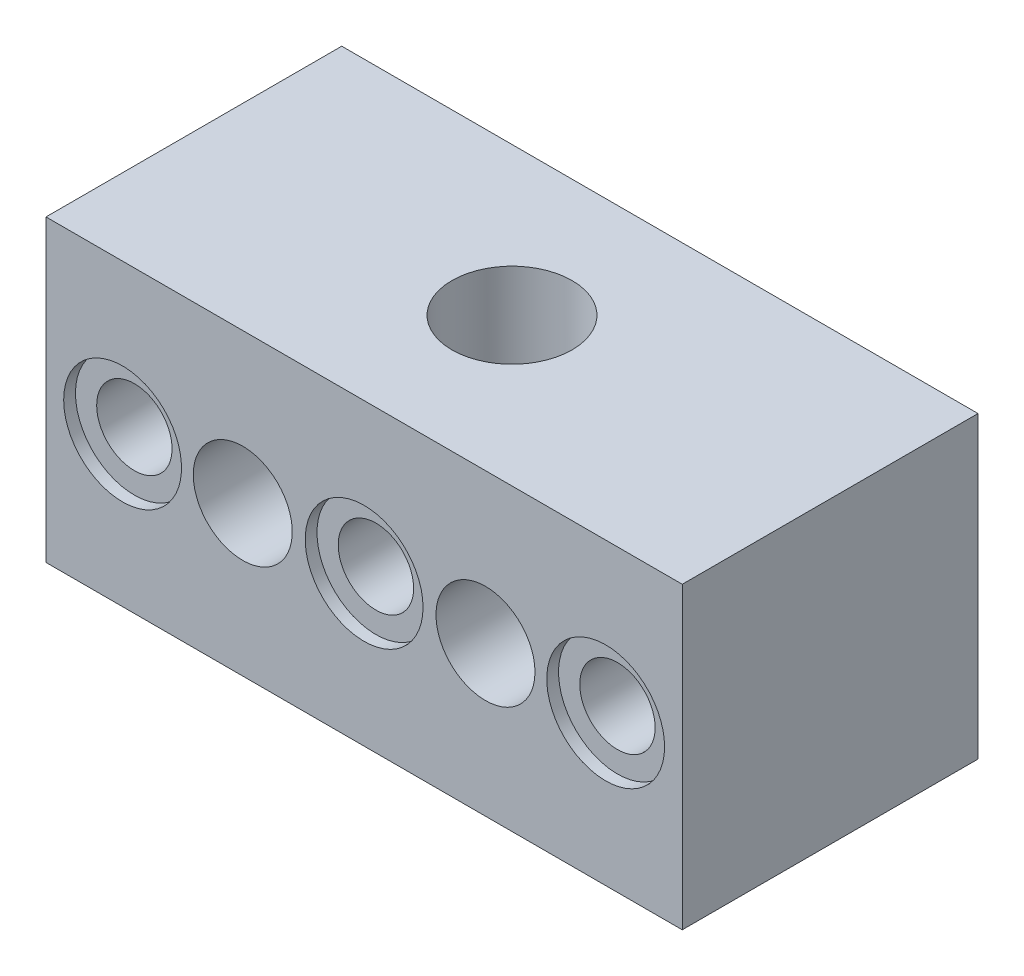
from build123d import *

# Parameters (mm, degrees)
BOSS_EXTRUDE1_DEPTH      = 12.55
BOSS_EXTRUDE1_DEPTH_BACK = 12.55
SKETCH1_W                = 54
SKETCH1_H                = 25.4
CUT_EXTRUDE1_REACH       = 41.136
SKETCH3_R                = 5.1
SKETCH5_R                = 5
CUT_EXTRUDE2_DEPTH       = 1
SKETCH6_R                = 3.2
CUT_EXTRUDE3_DEPTH       = 4.6
CUT_EXTRUDE4_REACH       = 37.645
SKETCH7_R                = 2
CUT_EXTRUDE5_REACH       = 40.991
SKETCH8_R                = 4.2
SKETCH9_R                = 5
CUT_EXTRUDE6_DEPTH       = 1
SKETCH10_R               = 3.2
CUT_EXTRUDE7_DEPTH       = 4.6
SKETCH11_R               = 2
CUT_EXTRUDE8_DEPTH       = 36.64463494


with BuildPart() as part:
    # Sketch1 → Boss-Extrude1 (new, two sides: drawn at the far end of the back side and taken through both)
    with BuildSketch(Plane.XY.offset(-BOSS_EXTRUDE1_DEPTH_BACK)):
        Rectangle(SKETCH1_W, SKETCH1_H)
    extrude(amount=BOSS_EXTRUDE1_DEPTH + BOSS_EXTRUDE1_DEPTH_BACK)

    # Sketch3 → Cut-Extrude1 (cut, up to next)
    with BuildSketch(Plane.XZ.offset(12.7), mode=Mode.PRIVATE) as cut_extrude1_sk1:
        Circle(SKETCH3_R)
    cut_extrude1_tool1 = extrude(cut_extrude1_sk1.sketch, amount=-CUT_EXTRUDE1_REACH, mode=Mode.PRIVATE) & part.part
    add(cut_extrude1_tool1.solids().sort_by_distance((0, -12.7, 0))[0], mode=Mode.SUBTRACT)

    # Sketch5 → Cut-Extrude2 (cut)
    with BuildSketch(Plane.XY.offset(12.55)):
        with Locations((20.5, 0)):
            Circle(SKETCH5_R)
        with Locations((-20.5, 0)):
            Circle(SKETCH5_R)
    cut_extrude2 = extrude(amount=-CUT_EXTRUDE2_DEPTH, mode=Mode.SUBTRACT)

    # Sketch6 → Cut-Extrude3 (cut)
    with BuildSketch(Plane.XY.offset(11.55)):
        with Locations((20.5, 0)):
            Circle(SKETCH6_R)
        with Locations((-20.5, 0)):
            Circle(SKETCH6_R)
    cut_extrude3 = extrude(amount=-CUT_EXTRUDE3_DEPTH, mode=Mode.SUBTRACT)

    # Sketch7 → Cut-Extrude4 (cut, up to next)
    with BuildSketch(Plane.XY.offset(6.95), mode=Mode.PRIVATE) as cut_extrude4_sk1:
        with Locations((20.5, 0)):
            Circle(SKETCH7_R)
    cut_extrude4_tool1 = extrude(cut_extrude4_sk1.sketch, amount=-CUT_EXTRUDE4_REACH, mode=Mode.PRIVATE) & part.part
    # Sketch7 → Cut-Extrude4 (cut, up to next)
    with BuildSketch(Plane.XY.offset(6.95), mode=Mode.PRIVATE) as cut_extrude4_sk2:
        with Locations((-20.5, 0)):
            Circle(SKETCH7_R)
    cut_extrude4_tool2 = extrude(cut_extrude4_sk2.sketch, amount=-CUT_EXTRUDE4_REACH, mode=Mode.PRIVATE) & part.part
    add(cut_extrude4_tool1.solids().sort_by_distance((20.5, 0, 6.95))[0], mode=Mode.SUBTRACT)
    add(cut_extrude4_tool2.solids().sort_by_distance((-20.5, 0, 6.95))[0], mode=Mode.SUBTRACT)

    # Mirror1: Cut-Extrude2 across plane
    add(cut_extrude2.mirror(Plane.XY), mode=Mode.SUBTRACT)

    # Mirror2: Cut-Extrude3 across plane
    add(cut_extrude3.mirror(Plane.XY), mode=Mode.SUBTRACT)

    # Sketch8 → Cut-Extrude5 (cut, up to next)
    with BuildSketch(Plane.XY.offset(12.55), mode=Mode.PRIVATE) as cut_extrude5_sk1:
        with Locations((10.3, 0)):
            Circle(SKETCH8_R)
    cut_extrude5_tool1 = extrude(cut_extrude5_sk1.sketch, amount=-CUT_EXTRUDE5_REACH, mode=Mode.PRIVATE) & part.part
    # Sketch8 → Cut-Extrude5 (cut, up to next)
    with BuildSketch(Plane.XY.offset(12.55), mode=Mode.PRIVATE) as cut_extrude5_sk2:
        with Locations((-10.3, 0)):
            Circle(SKETCH8_R)
    cut_extrude5_tool2 = extrude(cut_extrude5_sk2.sketch, amount=-CUT_EXTRUDE5_REACH, mode=Mode.PRIVATE) & part.part
    add(cut_extrude5_tool1.solids().sort_by_distance((10.3, 0, 12.55))[0], mode=Mode.SUBTRACT)
    add(cut_extrude5_tool2.solids().sort_by_distance((-10.3, 0, 12.55))[0], mode=Mode.SUBTRACT)

    # Sketch9 → Cut-Extrude6 (cut)
    with BuildSketch(Plane.XY.offset(12.55)):
        Circle(SKETCH9_R)
    cut_extrude6 = extrude(amount=-CUT_EXTRUDE6_DEPTH, mode=Mode.SUBTRACT)

    # Sketch10 → Cut-Extrude7 (cut)
    with BuildSketch(Plane.XY.offset(11.55)):
        Circle(SKETCH10_R)
    cut_extrude7 = extrude(amount=-CUT_EXTRUDE7_DEPTH, mode=Mode.SUBTRACT)

    # Sketch11 → Cut-Extrude8 (cut, through all)
    with BuildSketch(Plane.XY.offset(6.95)):
        Circle(SKETCH11_R)
    extrude(amount=-CUT_EXTRUDE8_DEPTH, mode=Mode.SUBTRACT)

    # Mirror3: Cut-Extrude6, Cut-Extrude7 across plane
    add(cut_extrude6.mirror(Plane.XY), mode=Mode.SUBTRACT)
    add(cut_extrude7.mirror(Plane.XY), mode=Mode.SUBTRACT)


solid = part.part
